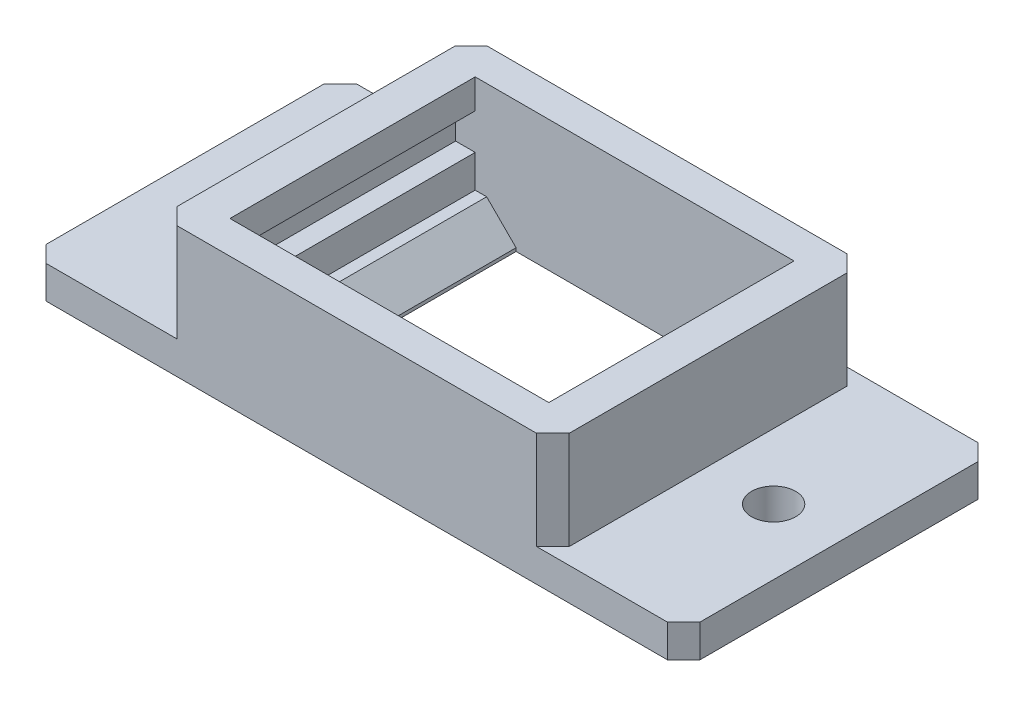
from build123d import *

# Parameters (mm, degrees)
SKETCH_1_W          = 40
SKETCH_1_H          = 19
EXTRUDE_1_DEPTH     = 8
SKETCH_2_W          = 42
SKETCH_2_H          = 21
SKETCH_2_W_2        = 24
SKETCH_2_H_2        = 19
CUT_EXTRUDE_1_DEPTH = 6
SKETCH_3_W          = 19.5
SKETCH_3_H          = 15
CUT_EXTRUDE_2_DEPTH = 6
SKETCH_5_W          = 17
SKETCH_5_H          = 15
CUT_EXTRUDE_3_DEPTH = 8
SKETCH_6_W          = 15
SKETCH_6_H          = 2.2
CUT_EXTRUDE_4_DEPTH = 1.2
CHAMFER_1_SIZE      = 1.8
CHAMFER_2_SIZE      = 1
CHAMFER_3_SIZE      = 1
SKETCH_7_R          = 1.35
CUT_EXTRUDE_5_DEPTH = 23.940139494


with BuildPart() as part:
    # Эскиз1 → Бобышка-Вытянуть1 (new body)
    with BuildSketch(Plane(origin=(0, 0, 0), x_dir=(1, 0, 0), z_dir=(0, 1, 0))):
        Rectangle(SKETCH_1_W, SKETCH_1_H)
    extrude(amount=EXTRUDE_1_DEPTH)

    # Эскиз2 → Вырез-Вытянуть1 (cut)
    with BuildSketch(Plane(origin=(0, 8, 0), x_dir=(1, 0, 0), z_dir=(0, 1, 0))):
        Rectangle(SKETCH_2_W, SKETCH_2_H)
        Rectangle(SKETCH_2_W_2, SKETCH_2_H_2, mode=Mode.SUBTRACT)
    extrude(amount=-CUT_EXTRUDE_1_DEPTH, mode=Mode.SUBTRACT)

    # Эскиз3 → Вырез-Вытянуть2 (cut)
    with BuildSketch(Plane(origin=(0, 8, 0), x_dir=(1, 0, 0), z_dir=(0, 1, 0))):
        Rectangle(SKETCH_3_W, SKETCH_3_H)
    extrude(amount=-CUT_EXTRUDE_2_DEPTH, mode=Mode.SUBTRACT)

    # Эскиз5 → Вырез-Вытянуть3 (cut)
    with BuildSketch(Plane(origin=(0, 2, 0), x_dir=(1, 0, 0), z_dir=(0, 1, 0))):
        with Locations((1.25, 0)):
            Rectangle(SKETCH_5_W, SKETCH_5_H)
    extrude(amount=-CUT_EXTRUDE_3_DEPTH, mode=Mode.SUBTRACT)

    # Эскиз6 → Вырез-Вытянуть4 (cut)
    with BuildSketch(Plane(origin=(-9.75, 0, 0), x_dir=(0, 0, -1), z_dir=(1, 0, 0))):
        with Locations((0, 5.1)):
            Rectangle(SKETCH_6_W, SKETCH_6_H)
    cut_extrude_4 = extrude(amount=-CUT_EXTRUDE_4_DEPTH, mode=Mode.SUBTRACT)

    # Зеркальное отражение1: Вырез-Вытянуть4 across plane
    add(cut_extrude_4.mirror(Plane(origin=(0, 0, 0), x_dir=(0, 0, 1), z_dir=(1, 0, 0))), mode=Mode.SUBTRACT)

    # Фаска1
    chamfer_1_edges = [part.edges().sort_by_distance(p)[0] for p in [
        (-7.25, 2, 0),
    ]]
    chamfer(chamfer_1_edges, length=CHAMFER_1_SIZE)

    # Фаска2
    chamfer_2_edges = [part.edges().sort_by_distance(p)[0] for p in [
        (-12, 5, -9.5),
        (12, 5, -9.5),
        (12, 5, 9.5),
        (-12, 5, 9.5),
    ]]
    chamfer(chamfer_2_edges, length=CHAMFER_2_SIZE)

    # Фаска3
    chamfer_3_edges = [part.edges().sort_by_distance(p)[0] for p in [
        (-20, 1, -9.5),
        (20, 1, -9.5),
        (20, 1, 9.5),
        (-20, 1, 9.5),
    ]]
    chamfer(chamfer_3_edges, length=CHAMFER_3_SIZE)

    # Эскиз7 → Вырез-Вытянуть5 (cut, through all)
    with BuildSketch(Plane(origin=(0, 2, 0), x_dir=(1, 0, 0), z_dir=(0, 1, 0))):
        with Locations(Location((-16, 0, 0), (0, 0, 270))):
            Circle(SKETCH_7_R)
        with Locations(Location((16, 0, 0), (0, 0, 270))):
            Circle(SKETCH_7_R)
    extrude(amount=-CUT_EXTRUDE_5_DEPTH, mode=Mode.SUBTRACT)


solid = part.part
